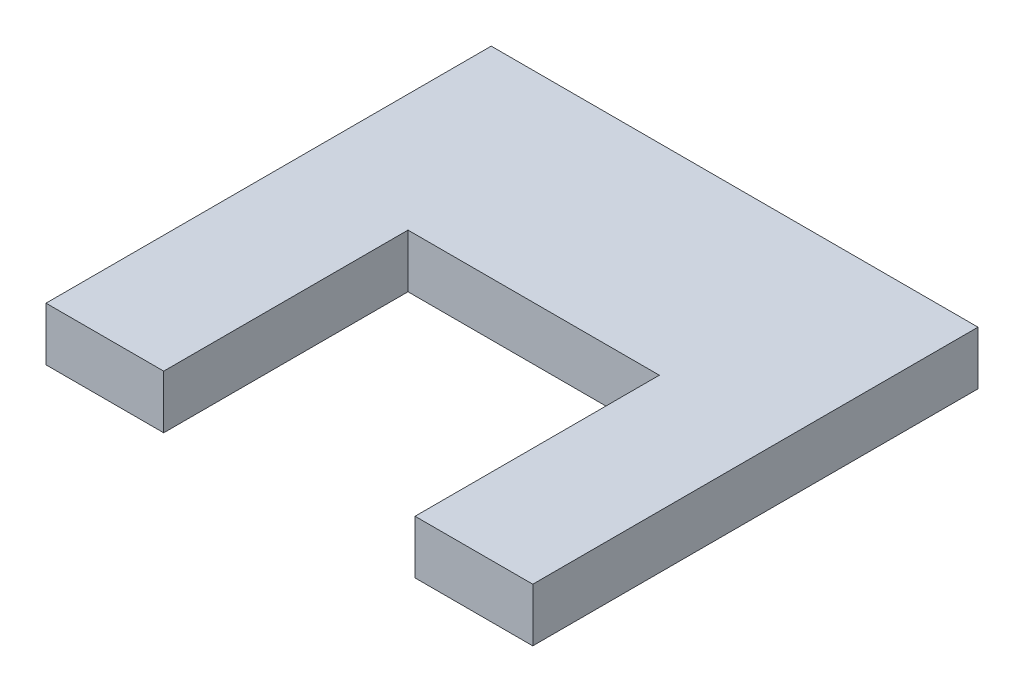
from build123d import *

# Parameters (mm, degrees)
SKETCH1_W           = 19.83
SKETCH1_H           = 41.15
SKETCH1_H_2         = 33.85
SKETCH1_W_2         = 42.34
BOSS_EXTRUDE1_DEPTH = 9


with BuildPart() as part:
    # Sketch1 → Boss-Extrude1 (new body)
    with BuildSketch(Plane(origin=(0, 0, 0), x_dir=(1, 0, 0), z_dir=(0, 1, 0))):
        with Locations((-31.085, -16.925)):
            Rectangle(SKETCH1_W, SKETCH1_H)
        with Locations((-31.085, 20.575)):
            Rectangle(SKETCH1_W, SKETCH1_H_2)
        with Locations((0, 20.575)):
            Rectangle(SKETCH1_W_2, SKETCH1_H_2)
        with Locations((31.085, 20.575)):
            Rectangle(SKETCH1_W, SKETCH1_H_2)
        with Locations((31.085, -16.925)):
            Rectangle(SKETCH1_W, SKETCH1_H)
    extrude(amount=BOSS_EXTRUDE1_DEPTH)


solid = part.part
